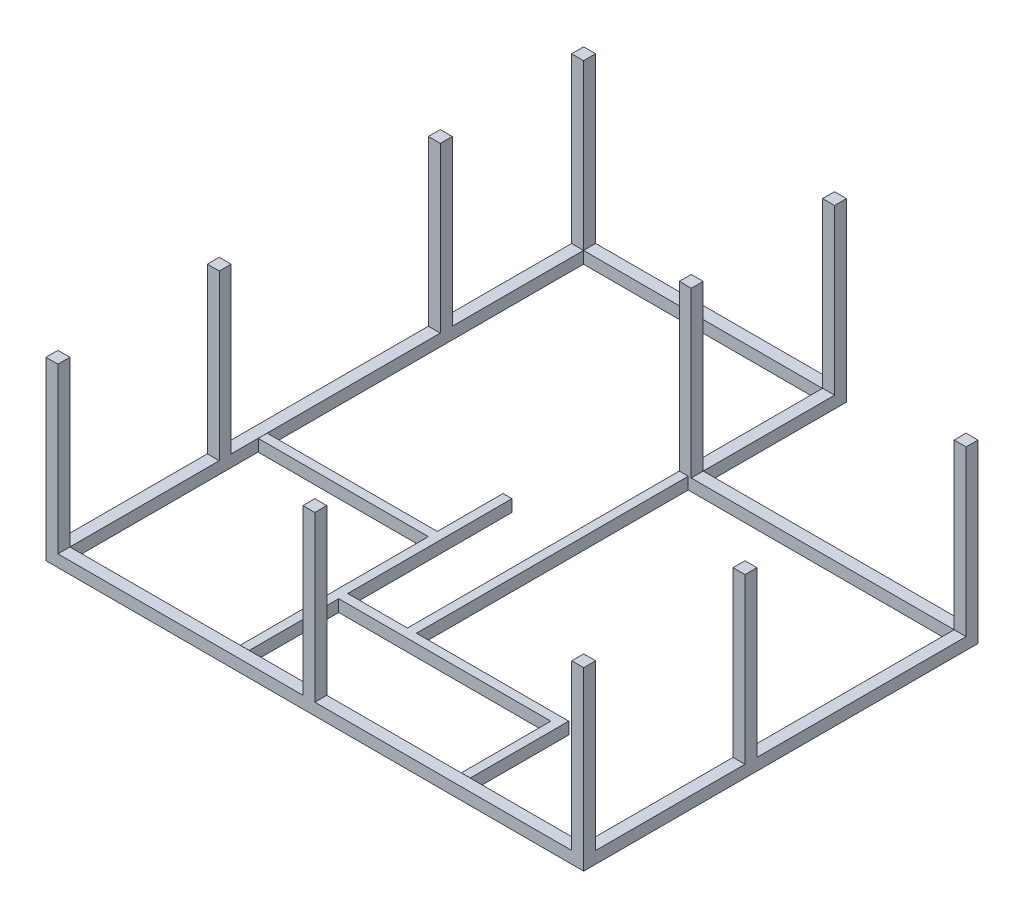
from build123d import *

# Parameters (mm, degrees)
EXTRUDE_1_DEPTH = 200
SKETCH_2_W      = 200
SKETCH_2_H      = 203
SKETCH_2_H_2    = 200
EXTRUDE_2_DEPTH = 2950


with BuildPart() as part:
    # Эскиз1 → Бобышка-Вытянуть1 (new body)
    with BuildSketch(Plane(origin=(0, 0, 0), x_dir=(-1, 0, 0), z_dir=(0, 1, 0))):
        Polygon((0, 0), (-9000, 0), (-9000, -6600), (-4400, -6600), (-4400, -9000), (0, -9000), align=None)
        Polygon((-200, -200), (-8800, -200), (-8800, -6400), (-4350, -6400), (-4350, -1850), (-6900, -1850), (-6900, -203), (-6750, -203), (-6750, -1700), (-3200, -1700), (-3200, -203), (-3050, -203), (-3050, -3350), (-203, -3350), (-203, -3500), (-3050, -3500), (-3050, -4600), (-3200, -4600), (-3200, -1850), (-4200, -1850), (-4200, -8797), (-200, -8797), align=None, mode=Mode.SUBTRACT)
    extrude(amount=-EXTRUDE_1_DEPTH)

    # Эскиз2 → Бобышка-Вытянуть2 (add)
    with BuildSketch(Plane(origin=(0, -200, 0), x_dir=(1, 0, 0), z_dir=(0, 1, 0))):
        with Locations((100, 8898.5)):
            Rectangle(SKETCH_2_W, SKETCH_2_H)
        with Locations((8900, 2800)):
            Rectangle(SKETCH_2_W, SKETCH_2_H_2)
        with Locations((4300, 8900)):
            Rectangle(SKETCH_2_W, SKETCH_2_H_2)
        with Locations((4300, 6500)):
            Rectangle(SKETCH_2_W, SKETCH_2_H_2)
        with Locations((4400, 100)):
            Rectangle(SKETCH_2_W, SKETCH_2_H_2)
        with Locations((8900, 6500)):
            Rectangle(SKETCH_2_W, SKETCH_2_H_2)
        with Locations((8900, 100)):
            Rectangle(SKETCH_2_W, SKETCH_2_H_2)
        with Locations((100, 100)):
            Rectangle(SKETCH_2_W, SKETCH_2_H_2)
        with Locations((100, 2800)):
            Rectangle(SKETCH_2_W, SKETCH_2_H_2)
        with Locations((100, 6500)):
            Rectangle(SKETCH_2_W, SKETCH_2_H_2)
    extrude(amount=EXTRUDE_2_DEPTH)


solid = part.part
